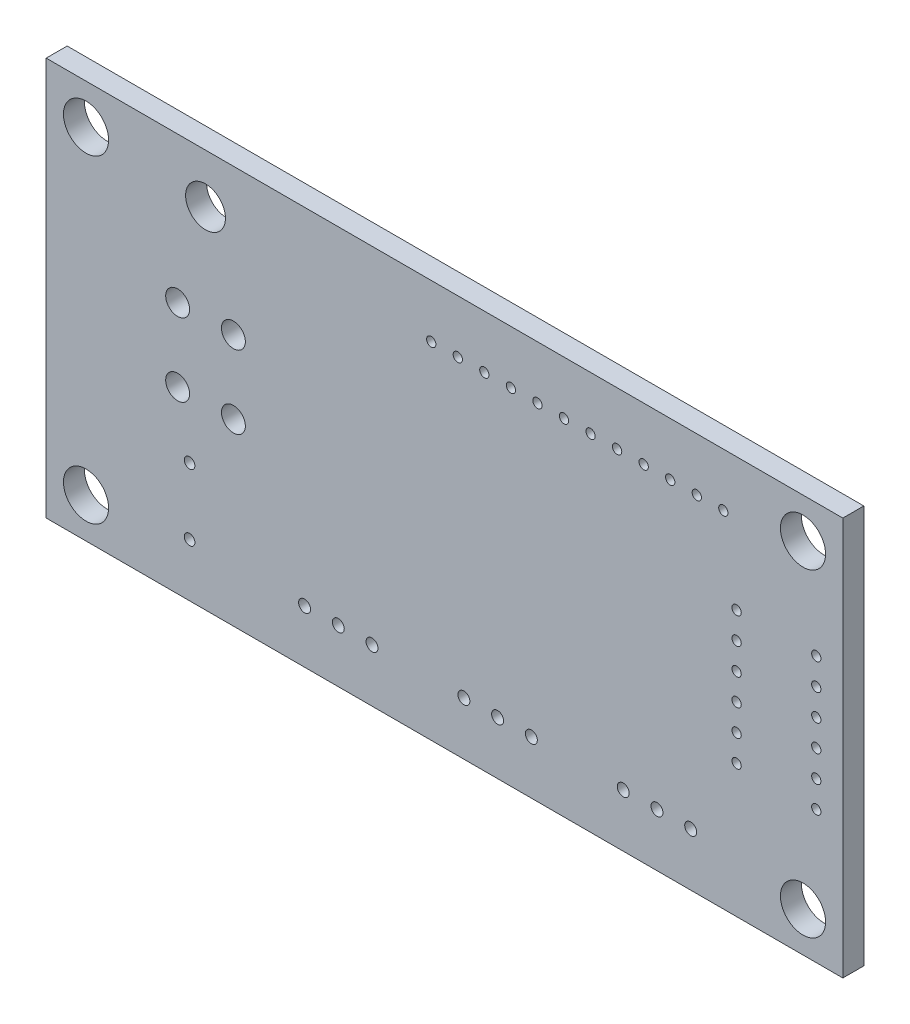
from build123d import *

# Parameters (mm, degrees)
SKETCH_1_W          = 60
SKETCH_1_H          = 30
BOARD_DEPTH         = 1.58
SKETCH_2_R          = 1.7
CUT_EXTRUDE_1_DEPTH = 1.58
SKETCH_3_R          = 1.7
CUT_EXTRUDE_2_DEPTH = 469.617644141
SKETCH_4_R          = 1.7
CUT_EXTRUDE_3_DEPTH = 469.617644141
SKETCH_5_R          = 1.7
CUT_EXTRUDE_4_DEPTH = 469.617644141
SKETCH_6_R          = 0.35
SKETCH_6_R_2        = 0.4
SKETCH_6_R_3        = 0.9
SKETCH_6_R_4        = 1.5
SKETCH_6_R_5        = 0.45
CUT_EXTRUDE_5_DEPTH = 469.617644141


with BuildPart() as part:
    # 草圖1 → Board (new body)
    with BuildSketch(Plane.XY):
        with Locations((330, 285)):
            Rectangle(SKETCH_1_W, SKETCH_1_H)
    extrude(amount=BOARD_DEPTH)

    # 草圖2 → 除料-伸長1 (cut)
    with BuildSketch(Plane.XY.offset(1.58)):
        with Locations((357, 297)):
            Circle(SKETCH_2_R)
    extrude(amount=-CUT_EXTRUDE_1_DEPTH, mode=Mode.SUBTRACT)

    # 草圖3 → 除料-伸長2 (cut, through all)
    with BuildSketch(Plane.XY.offset(1.58)):
        with Locations((357, 273)):
            Circle(SKETCH_3_R)
    extrude(amount=-CUT_EXTRUDE_2_DEPTH, mode=Mode.SUBTRACT)

    # 草圖4 → 除料-伸長3 (cut, through all)
    with BuildSketch(Plane.XY.offset(1.58)):
        with Locations((303, 273)):
            Circle(SKETCH_4_R)
    extrude(amount=-CUT_EXTRUDE_3_DEPTH, mode=Mode.SUBTRACT)

    # 草圖5 → 除料-伸長4 (cut, through all)
    with BuildSketch(Plane.XY.offset(1.58)):
        with Locations((303, 297)):
            Circle(SKETCH_5_R)
    extrude(amount=-CUT_EXTRUDE_4_DEPTH, mode=Mode.SUBTRACT)

    # 草圖6 → 除料-伸長5 (cut, through all)
    with BuildSketch(Plane.XY.offset(1.58)):
        with Locations((337, 296)):
            Circle(SKETCH_6_R)
        with Locations((328.99999, 296)):
            Circle(SKETCH_6_R)
        with Locations((335, 296)):
            Circle(SKETCH_6_R)
        with Locations((333, 296)):
            Circle(SKETCH_6_R)
        with Locations((331, 296)):
            Circle(SKETCH_6_R)
        with Locations((339, 296)):
            Circle(SKETCH_6_R)
        with Locations((310.8, 274)):
            Circle(SKETCH_6_R_2)
        with Locations((310.8, 279)):
            Circle(SKETCH_6_R_2)
        with Locations((352, 290)):
            Circle(SKETCH_6_R)
        with Locations((352, 288)):
            Circle(SKETCH_6_R)
        with Locations((352, 286)):
            Circle(SKETCH_6_R)
        with Locations((352, 282)):
            Circle(SKETCH_6_R)
        with Locations((352, 284)):
            Circle(SKETCH_6_R)
        with Locations((352, 280)):
            Circle(SKETCH_6_R)
        with Locations((309.9, 289)):
            Circle(SKETCH_6_R_3)
        with Locations((314.1, 289)):
            Circle(SKETCH_6_R_3)
        with Locations((309.9, 283.5)):
            Circle(SKETCH_6_R_3)
        with Locations((312, 296.3)):
            Circle(SKETCH_6_R_4)
        with Locations((314.1, 283.5)):
            Circle(SKETCH_6_R_3)
        with Locations((358, 290)):
            Circle(SKETCH_6_R)
        with Locations((358, 288)):
            Circle(SKETCH_6_R)
        with Locations((358, 286)):
            Circle(SKETCH_6_R)
        with Locations((358, 282)):
            Circle(SKETCH_6_R)
        with Locations((358, 284)):
            Circle(SKETCH_6_R)
        with Locations((358, 280)):
            Circle(SKETCH_6_R)
        with Locations((331.46, 274)):
            Circle(SKETCH_6_R_5)
        with Locations((336.54, 274)):
            Circle(SKETCH_6_R_5)
        with Locations((334, 274)):
            Circle(SKETCH_6_R_5)
        with Locations((343, 296)):
            Circle(SKETCH_6_R)
        with Locations((341, 296)):
            Circle(SKETCH_6_R)
        with Locations((345, 296)):
            Circle(SKETCH_6_R)
        with Locations((347, 296)):
            Circle(SKETCH_6_R)
        with Locations((349, 296)):
            Circle(SKETCH_6_R)
        with Locations((351, 296)):
            Circle(SKETCH_6_R)
        with Locations((319.46, 274)):
            Circle(SKETCH_6_R_5)
        with Locations((324.54, 274)):
            Circle(SKETCH_6_R_5)
        with Locations((322, 274)):
            Circle(SKETCH_6_R_5)
        with Locations((348.54, 274)):
            Circle(SKETCH_6_R_5)
        with Locations((346, 274)):
            Circle(SKETCH_6_R_5)
        with Locations((343.46, 274)):
            Circle(SKETCH_6_R_5)
    extrude(amount=-CUT_EXTRUDE_5_DEPTH, mode=Mode.SUBTRACT)


solid = part.part
